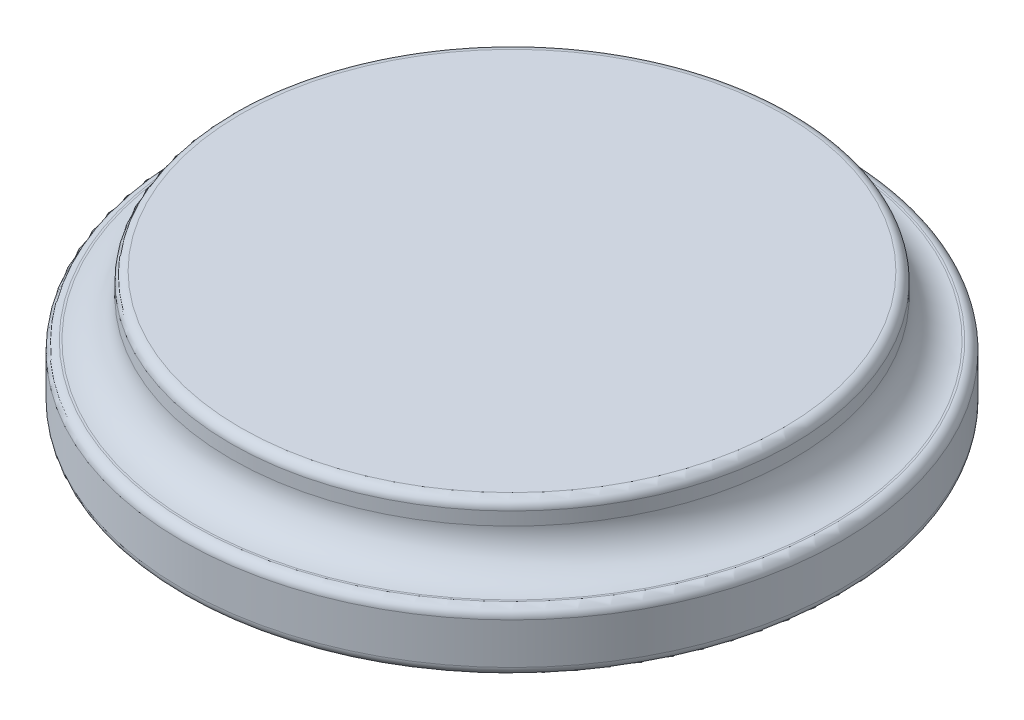
from build123d import *

# Parameters (mm, degrees)
SKETCH1_R           = 17.6
BOSS_EXTRUDE1_DEPTH = 3.2
SKETCH2_R           = 15
BOSS_EXTRUDE2_DEPTH = 3.2
FILLET1_R           = 2
FILLET2_R           = 0.5
FILLET3_R           = 0.5
FILLET4_R           = 0.5


with BuildPart() as part:
    # Sketch1 → Boss-Extrude1 (new body)
    with BuildSketch(Plane(origin=(0, 0, 0), x_dir=(1, 0, 0), z_dir=(0, 1, 0))):
        with Locations(Location((0, 0, 0), (0, 0, 270))):
            Circle(SKETCH1_R)
    extrude(amount=BOSS_EXTRUDE1_DEPTH)

    # Sketch2 → Boss-Extrude2 (add)
    with BuildSketch(Plane(origin=(0, 3.2, 0), x_dir=(1, 0, 0), z_dir=(0, 1, 0))):
        with Locations(Location((0, 0, 0), (0, 0, 270))):
            Circle(SKETCH2_R)
    extrude(amount=BOSS_EXTRUDE2_DEPTH)

    # Fillet1
    fillet1_edges = [part.edges().sort_by_distance(p)[0] for p in [
        (0, 3.2, -15),
    ]]
    fillet(fillet1_edges, radius=FILLET1_R)

    # Fillet2
    fillet2_edges = [part.edges().sort_by_distance(p)[0] for p in [
        (0, 6.4, -15),
    ]]
    fillet(fillet2_edges, radius=FILLET2_R)

    # Fillet3
    fillet3_edges = [part.edges().sort_by_distance(p)[0] for p in [
        (0, 3.2, -17.6),
    ]]
    fillet(fillet3_edges, radius=FILLET3_R)

    # Fillet4
    fillet4_edges = [part.edges().sort_by_distance(p)[0] for p in [
        (0, 0, -17.6),
    ]]
    fillet(fillet4_edges, radius=FILLET4_R)


solid = part.part
